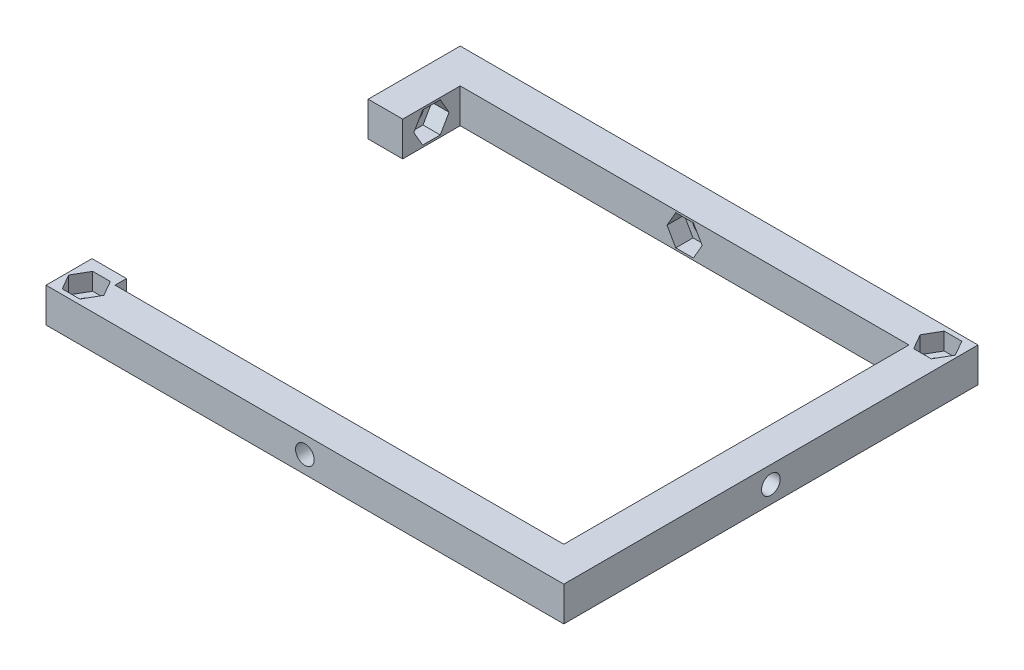
from build123d import *

# Parameters (mm, degrees)
CROQUIS1_W              = 90
CROQUIS1_H              = 72
SALIENTE_EXTRUIR1_DEPTH = 6
CROQUIS2_R              = 1.5
CROQUIS2_W              = 78
CROQUIS2_H              = 60
CORTAR_EXTRUIR1_DEPTH   = 58.939623747
CORTAR_EXTRUIR2_DEPTH   = 3
CROQUIS4_R              = 1.625
CORTAR_EXTRUIR3_DEPTH   = 86.117565755
CORTAR_EXTRUIR4_REACH   = 99.118
CROQUIS5_R              = 1.625
CORTAR_EXTRUIR5_START   = -6
CROQUIS6_OUTSIDE_W      = 115.082
CROQUIS6_OUTSIDE_H      = 31.082
CROQUIS6_OUTSIDE_W_2    = 90
CROQUIS6_OUTSIDE_H_2    = 6
CORTAR_EXTRUIR5_DEPTH   = 3
CORTAR_EXTRUIR6_START   = -6
CORTAR_EXTRUIR6_DEPTH   = 3
CORTAR_EXTRUIR8_START   = -66
CROQUIS6_2_OUTSIDE_W    = 115.082
CROQUIS6_2_OUTSIDE_H    = 31.082
CROQUIS6_2_OUTSIDE_W_2  = 90
CROQUIS6_2_OUTSIDE_H_2  = 6
CORTAR_EXTRUIR8_DEPTH   = 3
CORTAR_EXTRUIR9_DEPTH   = 3
CORTAR_EXTRUIR10_REACH  = 93.586
CROQUIS10_R             = 1.625
CORTAR_EXTRUIR12_REACH  = 59.94
CROQUIS11_W             = 6
CROQUIS11_H             = 48


with BuildPart() as part:
    # Croquis1 → Saliente-Extruir1 (new body)
    with BuildSketch(Plane(origin=(0, 0, 0), x_dir=(1, 0, 0), z_dir=(0, 1, 0))):
        Rectangle(CROQUIS1_W, CROQUIS1_H)
    extrude(amount=SALIENTE_EXTRUIR1_DEPTH)

    # Croquis2 → Cortar-Extruir1 (cut, through all)
    with BuildSketch(Plane(origin=(0, 6, 0), x_dir=(1, 0, 0), z_dir=(0, 1, 0))):
        with Locations(Location((-41.5, -32.5, 0), (0, 0, 270))):
            Circle(CROQUIS2_R)
        with Locations(Location((41.5, 32.5, 0), (0, 0, 270))):
            Circle(CROQUIS2_R)
        Rectangle(CROQUIS2_W, CROQUIS2_H)
    extrude(amount=-CORTAR_EXTRUIR1_DEPTH, mode=Mode.SUBTRACT)

    # Croquis3 → Cortar-Extruir2 (cut)
    with BuildSketch(Plane(origin=(0, 6, 0), x_dir=(1, 0, 0), z_dir=(0, 1, 0))):
        Polygon((-39.970021787, -29.85), (-43.029978213, -29.85), (-44.559956427, -32.5), (-43.029978213, -35.15), (-39.970021787, -35.15), (-38.440043573, -32.5), align=None)
        Polygon((43.029978213, 35.15), (39.970021787, 35.15), (38.440043573, 32.5), (39.970021787, 29.85), (43.029978213, 29.85), (44.559956427, 32.5), align=None)
    extrude(amount=-CORTAR_EXTRUIR2_DEPTH, mode=Mode.SUBTRACT)

    # Croquis4 → Cortar-Extruir3 (cut, through all)
    with BuildSketch(Plane.XY.offset(36)):
        with Locations((0, 3)):
            Circle(CROQUIS4_R)
    extrude(amount=-CORTAR_EXTRUIR3_DEPTH, mode=Mode.SUBTRACT)

    # Croquis5 → Cortar-Extruir4 (cut, up to next)
    with BuildSketch(Plane(origin=(45, 0, 0), x_dir=(0, 0, -1), z_dir=(1, 0, 0)), mode=Mode.PRIVATE) as cortar_extruir4_sk1:
        with Locations((0, 3)):
            Circle(CROQUIS5_R)
    cortar_extruir4_tool1 = extrude(cortar_extruir4_sk1.sketch, amount=-CORTAR_EXTRUIR4_REACH, mode=Mode.PRIVATE) & part.part
    add(cortar_extruir4_tool1.solids().sort_by_distance((45, 3, 0))[0], mode=Mode.SUBTRACT)

    # Croquis6 outside → Cortar-Extruir5 (cut)
    # profile 1 of 2: a face of its own
    with BuildSketch(Plane.XY.offset(36).offset(CORTAR_EXTRUIR5_START)):
        with Locations((0, 3)):
            Rectangle(CROQUIS6_OUTSIDE_W, CROQUIS6_OUTSIDE_H)
        with Locations((0, 3)):
            Rectangle(CROQUIS6_OUTSIDE_W_2, CROQUIS6_OUTSIDE_H_2, mode=Mode.SUBTRACT)
    # profile 2 of 2: a face of its own
    with BuildSketch(Plane.XY.offset(36).offset(CORTAR_EXTRUIR5_START)):
        Polygon((1.529978213, 5.65), (-1.529978213, 5.65), (-3.059956427, 3), (-1.529978213, 0.35), (1.529978213, 0.35), (3.059956427, 3), align=None)
    extrude(amount=CORTAR_EXTRUIR5_DEPTH, mode=Mode.SUBTRACT)

    # Croquis8 → Cortar-Extruir6 (cut)
    with BuildSketch(Plane.ZY.offset(45).offset(CORTAR_EXTRUIR6_START)):
        Polygon((-23.470021787, 5.65), (-26.529978213, 5.65), (-28.059956427, 3), (-26.529978213, 0.35), (-23.470021787, 0.35), (-21.940043573, 3), align=None)
    extrude(amount=CORTAR_EXTRUIR6_DEPTH, mode=Mode.SUBTRACT)

    # Croquis6<2> outside → Cortar-Extruir8 (cut)
    # profile 1 of 2: a face of its own
    with BuildSketch(Plane.XY.offset(36).offset(CORTAR_EXTRUIR8_START)):
        with Locations((0, 3)):
            Rectangle(CROQUIS6_2_OUTSIDE_W, CROQUIS6_2_OUTSIDE_H)
        with Locations((0, 3)):
            Rectangle(CROQUIS6_2_OUTSIDE_W_2, CROQUIS6_2_OUTSIDE_H_2, mode=Mode.SUBTRACT)
    # profile 2 of 2: a face of its own
    with BuildSketch(Plane.XY.offset(36).offset(CORTAR_EXTRUIR8_START)):
        Polygon((1.529978213, 5.65), (-1.529978213, 5.65), (-3.059956427, 3), (-1.529978213, 0.35), (1.529978213, 0.35), (3.059956427, 3), align=None)
    extrude(amount=-CORTAR_EXTRUIR8_DEPTH, mode=Mode.SUBTRACT)

    # Croquis9 → Cortar-Extruir9 (cut)
    with BuildSketch(Plane.ZY.offset(-39)):
        Polygon((1.529978213, 5.65), (-1.529978213, 5.65), (-3.059956427, 3), (-1.529978213, 0.35), (1.529978213, 0.35), (3.059956427, 3), align=None)
    extrude(amount=-CORTAR_EXTRUIR9_DEPTH, mode=Mode.SUBTRACT)

    # Croquis10 → Cortar-Extruir10 (cut, up to next)
    with BuildSketch(Plane(origin=(-39, 0, 0), x_dir=(0, 0, -1), z_dir=(1, 0, 0)), mode=Mode.PRIVATE) as cortar_extruir10_sk1:
        with Locations((25, 3)):
            Circle(CROQUIS10_R)
    cortar_extruir10_tool1 = extrude(cortar_extruir10_sk1.sketch, amount=-CORTAR_EXTRUIR10_REACH, mode=Mode.PRIVATE) & part.part
    add(cortar_extruir10_tool1.solids().sort_by_distance((-39, 3, -25))[0], mode=Mode.SUBTRACT)

    # Croquis11 → Cortar-Extruir12 (cut, up to next)
    with BuildSketch(Plane(origin=(0, 6, 0), x_dir=(1, 0, 0), z_dir=(0, 1, 0)), mode=Mode.PRIVATE) as cortar_extruir12_sk1:
        with Locations((-42, -4)):
            Rectangle(CROQUIS11_W, CROQUIS11_H)
    cortar_extruir12_tool1 = extrude(cortar_extruir12_sk1.sketch, amount=-CORTAR_EXTRUIR12_REACH, mode=Mode.PRIVATE) & part.part
    add(cortar_extruir12_tool1.solids().sort_by_distance((-42, 6, 4))[0], mode=Mode.SUBTRACT)


solid = part.part
